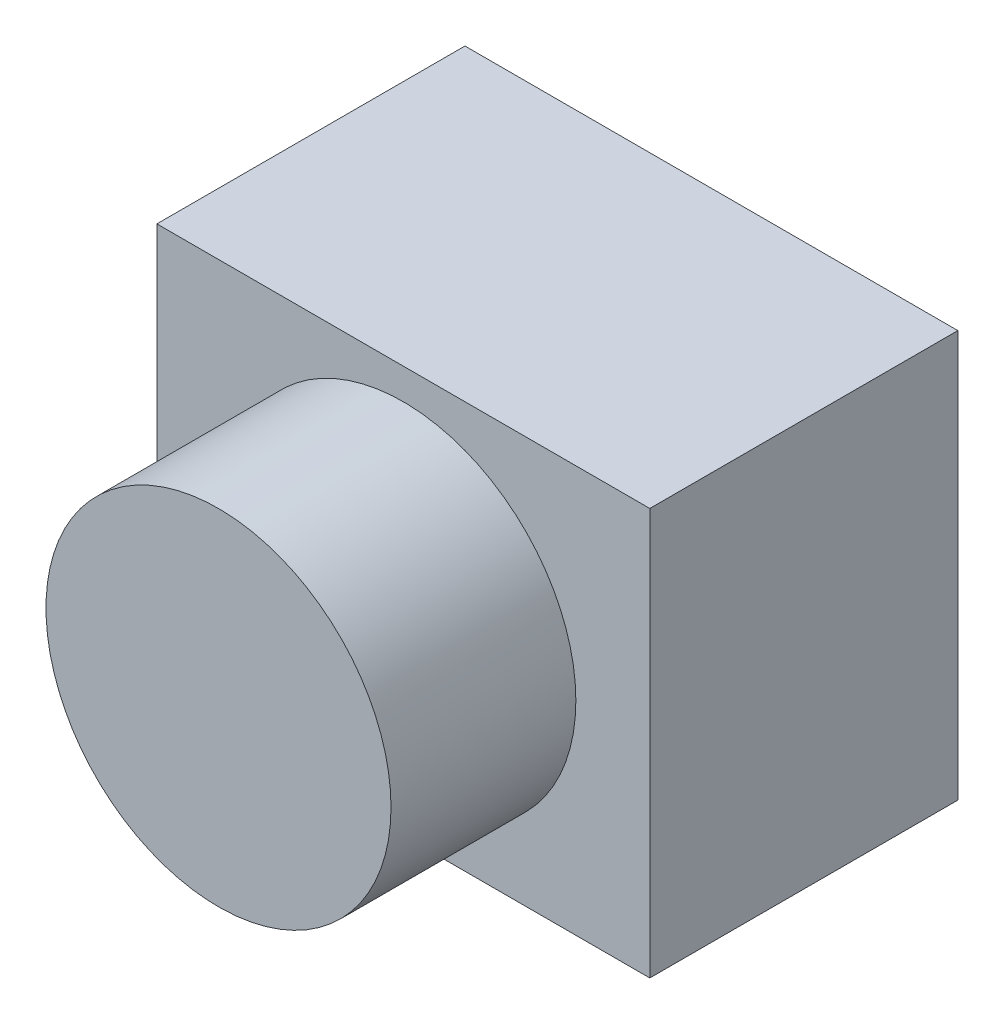
from build123d import *

# Parameters (mm, degrees)
SKETCH2_W           = 80
SKETCH2_H           = 66
BOSS_EXTRUDE2_DEPTH = 50
SKETCH4_R           = 28
BOSS_EXTRUDE3_DEPTH = 30


with BuildPart() as part:
    # Sketch2 → Boss-Extrude2 (new body)
    with BuildSketch(Plane.XY):
        with Locations((6.956521739, -0.065217391)):
            Rectangle(SKETCH2_W, SKETCH2_H)
    extrude(amount=BOSS_EXTRUDE2_DEPTH)

    # Sketch4 → Boss-Extrude3 (add)
    with BuildSketch(Plane.XY.offset(50)):
        with Locations((6.956521739, -0.065217391)):
            Circle(SKETCH4_R)
    extrude(amount=BOSS_EXTRUDE3_DEPTH)


solid = part.part
